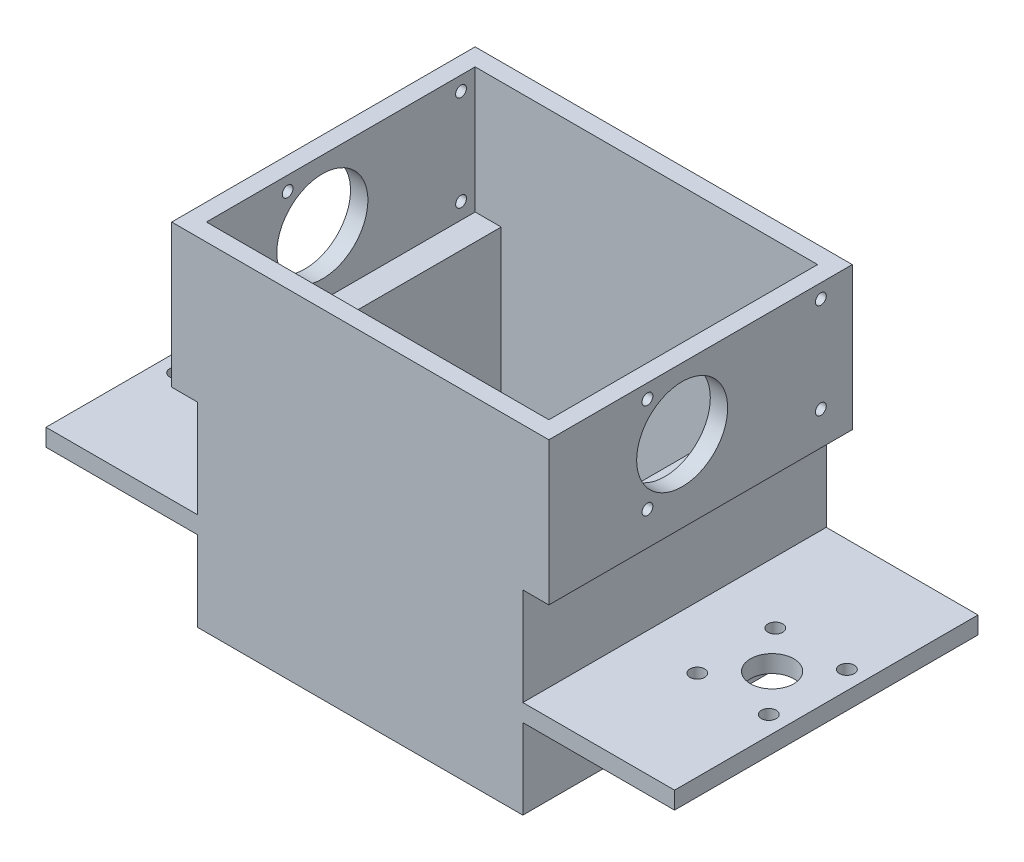
from build123d import *

# Parameters (mm, degrees)
SKETCH1_W                = 75
SKETCH1_H                = 40
SKETCH1_R                = 5
SKETCH1_R_2              = 1.7
SKETCH1_R_3              = 1.197563381
SKETCH1_W_2              = 5
SKETCH1_H_2              = 20
BOSS_EXTRUDE1_DEPTH      = 3
CUT_EXTRUDE1_DEPTH       = 43.605750786
CUT_EXTRUDE1_DEPTH_BACK  = 43.605750786
SKETCH2_W                = 67
SKETCH2_H                = 28
BOSS_EXTRUDE3_DEPTH      = 75
BOSS_EXTRUDE3_DEPTH_BACK = 3
SKETCH6_W                = 67
SKETCH6_H                = 11
CUT_EXTRUDE4_DEPTH       = 91.863909227
SKETCH7_W                = 70
SKETCH7_H                = 37
BOSS_EXTRUDE4_DEPTH      = 6
SKETCH8_W                = 6
SKETCH8_H                = 62
CUT_EXTRUDE6_DEPTH       = 29
SKETCH9_R                = 1.25
SKETCH9_R_2              = 10.5
CUT_EXTRUDE8_DEPTH       = 122.975407357
SKETCH11_W               = 6
SKETCH11_H               = 4
CUT_EXTRUDE9_DEPTH       = 114.473565204
SKETCH12_W               = 35
SKETCH12_H               = 4
BOSS_EXTRUDE5_DEPTH      = 70
SKETCH13_R               = 5
SKETCH13_R_2             = 1.7
CUT_EXTRUDE11_DEPTH      = 10


with BuildPart() as part:
    # Sketch1 → Boss-Extrude1 (new body)
    with BuildSketch(Plane(origin=(0, 0, 0), x_dir=(1, 0, 0), z_dir=(0, 1, 0))):
        Rectangle(SKETCH1_W, SKETCH1_H)
        with Locations(Location((-21, 0, 0), (0, 0, 270))):
            Circle(SKETCH1_R, mode=Mode.SUBTRACT)
        with Locations(Location((-30, 8.25, 0), (0, 0, 270))):
            Circle(SKETCH1_R_2, mode=Mode.SUBTRACT)
        with Locations(Location((-12, 8.25, 0), (0, 0, 270))):
            Circle(SKETCH1_R_2, mode=Mode.SUBTRACT)
        with Locations(Location((-12, -8.25, 0), (0, 0, 270))):
            Circle(SKETCH1_R_2, mode=Mode.SUBTRACT)
        with Locations(Location((-30, -8.25, 0), (0, 0, 270))):
            Circle(SKETCH1_R_2, mode=Mode.SUBTRACT)
        with Locations(Location((12, 8.25, 0), (0, 0, 90))):
            Circle(SKETCH1_R_2, mode=Mode.SUBTRACT)
        with Locations(Location((12, -8.25, 0), (0, 0, 90))):
            Circle(SKETCH1_R_2, mode=Mode.SUBTRACT)
        with Locations(Location((21, 0, 0), (0, 0, 90))):
            Circle(SKETCH1_R, mode=Mode.SUBTRACT)
        with Locations(Location((30, -8.25, 0), (0, 0, 90))):
            Circle(SKETCH1_R_2, mode=Mode.SUBTRACT)
        with Locations(Location((30, 8.25, 0), (0, 0, 90))):
            Circle(SKETCH1_R_2, mode=Mode.SUBTRACT)
        with Locations(Location((-30, -17.5, 0), (0, 0, 270))):
            Circle(SKETCH1_R_3, mode=Mode.SUBTRACT)
        with Locations(Location((-13.5, -17.5, 0), (0, 0, 270))):
            Circle(SKETCH1_R_3, mode=Mode.SUBTRACT)
        with Locations(Location((13.5, -17.5, 0), (0, 0, 90))):
            Circle(SKETCH1_R_3, mode=Mode.SUBTRACT)
        with Locations(Location((30, -17.5, 0), (0, 0, 90))):
            Circle(SKETCH1_R_3, mode=Mode.SUBTRACT)
        with Locations(Location((30, 17.5, 0), (0, 0, 270))):
            Circle(SKETCH1_R_3, mode=Mode.SUBTRACT)
        with Locations(Location((13.5, 17.5, 0), (0, 0, 270))):
            Circle(SKETCH1_R_3, mode=Mode.SUBTRACT)
        with Locations(Location((-13.5, 17.5, 0), (0, 0, 90))):
            Circle(SKETCH1_R_3, mode=Mode.SUBTRACT)
        with Locations(Location((-30, 17.5, 0), (0, 0, 90))):
            Circle(SKETCH1_R_3, mode=Mode.SUBTRACT)
        Rectangle(SKETCH1_W_2, SKETCH1_H_2, mode=Mode.SUBTRACT)
    extrude(amount=BOSS_EXTRUDE1_DEPTH)

    # Sketch2 → Cut-Extrude1 (cut, two sides: drawn at the far end of the back side and taken through both)
    with BuildSketch(Plane(origin=(0, 3, 0), x_dir=(1, 0, 0), z_dir=(0, 1, 0)).offset(-CUT_EXTRUDE1_DEPTH_BACK)):
        Rectangle(SKETCH2_W, SKETCH2_H)
    extrude(amount=CUT_EXTRUDE1_DEPTH + CUT_EXTRUDE1_DEPTH_BACK, mode=Mode.SUBTRACT)

    # Sketch3 → Boss-Extrude3 (add, two sides: drawn at the far end of the back side and taken through both)
    with BuildSketch(Plane(origin=(0, 3, 0), x_dir=(1, 0, 0), z_dir=(0, 1, 0)).offset(-BOSS_EXTRUDE3_DEPTH_BACK)):
        Polygon((37.5, -35), (37.5, -20), (33.5, -20), (-33.5, -20), (-37.5, -20), (-37.5, -35), align=None)
        Polygon((33.5, 20), (37.5, 20), (37.5, 35), (-37.5, 35), (-37.5, 20), (-33.5, 20), align=None)
        Polygon((37.5, -20), (37.5, 20), (33.5, 20), (33.5, 14), (33.5, -14), (33.5, -20), align=None)
        Polygon((-33.5, 14), (-33.5, 20), (-37.5, 20), (-37.5, -20), (-33.5, -20), (-33.5, -14), align=None)
    extrude(amount=BOSS_EXTRUDE3_DEPTH + BOSS_EXTRUDE3_DEPTH_BACK)

    # Sketch6 → Cut-Extrude4 (cut, through all)
    with BuildSketch(Plane(origin=(0, 3, 0), x_dir=(1, 0, 0), z_dir=(0, 1, 0))):
        with Locations((0, -25.5)):
            Rectangle(SKETCH6_W, SKETCH6_H)
        with Locations((0, 25.5)):
            Rectangle(SKETCH6_W, SKETCH6_H)
    extrude(amount=CUT_EXTRUDE4_DEPTH, mode=Mode.SUBTRACT)

    # Sketch7 → Boss-Extrude4 (add)
    with BuildSketch(Plane.ZY.offset(37.5)):
        with Locations((0, 59.5)):
            Rectangle(SKETCH7_W, SKETCH7_H)
    boss_extrude4 = extrude(amount=BOSS_EXTRUDE4_DEPTH)

    # Mirror2: Boss-Extrude4 across plane
    add(boss_extrude4.mirror(Plane(origin=(0, 0, 0), x_dir=(0, 0, 1), z_dir=(1, 0, 0))))

    # Sketch8 → Cut-Extrude6 (cut)
    with BuildSketch(Plane(origin=(0, 78, 0), x_dir=(1, 0, 0), z_dir=(0, 1, 0))):
        with Locations((-36.5, 0)):
            Rectangle(SKETCH8_W, SKETCH8_H)
        with Locations((36.5, 0)):
            Rectangle(SKETCH8_W, SKETCH8_H)
    extrude(amount=-CUT_EXTRUDE6_DEPTH, mode=Mode.SUBTRACT)

    # Sketch9 → Cut-Extrude8 (cut, through all)
    with BuildSketch(Plane.ZY.offset(43.5)):
        with Locations((-27.75, 74.75)):
            Circle(SKETCH9_R)
        with Locations((-27.75, 52.75)):
            Circle(SKETCH9_R)
        with Locations((4.25, 63.75)):
            Circle(SKETCH9_R_2)
        with Locations((12.25, 52.75)):
            Circle(SKETCH9_R)
        with Locations((12.25, 74.75)):
            Circle(SKETCH9_R)
    extrude(amount=-CUT_EXTRUDE8_DEPTH, mode=Mode.SUBTRACT)

    # Sketch11 → Cut-Extrude9 (cut, through all)
    with BuildSketch(Plane.XY.offset(35)):
        with Locations((-40.5, 43)):
            Rectangle(SKETCH11_W, SKETCH11_H)
        with Locations((40.5, 43)):
            Rectangle(SKETCH11_W, SKETCH11_H)
    extrude(amount=-CUT_EXTRUDE9_DEPTH, mode=Mode.SUBTRACT)

    # Sketch12 → Boss-Extrude5 (add)
    with BuildSketch(Plane.XY.offset(35)):
        with Locations((-55, 20.5)):
            Rectangle(SKETCH12_W, SKETCH12_H)
    boss_extrude5 = extrude(amount=-BOSS_EXTRUDE5_DEPTH)

    # Mirror3: Boss-Extrude5 across plane
    add(boss_extrude5.mirror(Plane(origin=(0, 0, 0), x_dir=(0, 0, 1), z_dir=(1, 0, 0))))

    # Sketch13 → Cut-Extrude11 (cut)
    with BuildSketch(Plane(origin=(0, 22.5, 0), x_dir=(1, 0, 0), z_dir=(0, 1, 0))):
        with Locations(Location((-60, 0, 0), (0, 0, 270))):
            Circle(SKETCH13_R)
        with Locations(Location((-68.25, 9, 0), (0, 0, 270))):
            Circle(SKETCH13_R_2)
        with Locations(Location((-51.75, 9, 0), (0, 0, 270))):
            Circle(SKETCH13_R_2)
        with Locations(Location((-51.75, -9, 0), (0, 0, 270))):
            Circle(SKETCH13_R_2)
        with Locations(Location((-68.25, -9, 0), (0, 0, 270))):
            Circle(SKETCH13_R_2)
        with Locations((68.25, -9)):
            Circle(SKETCH13_R_2)
        with Locations((51.75, -9)):
            Circle(SKETCH13_R_2)
        with Locations((51.75, 9)):
            Circle(SKETCH13_R_2)
        with Locations((68.25, 9)):
            Circle(SKETCH13_R_2)
        with Locations((60, 0)):
            Circle(SKETCH13_R)
    extrude(amount=-CUT_EXTRUDE11_DEPTH, mode=Mode.SUBTRACT)


solid = part.part
